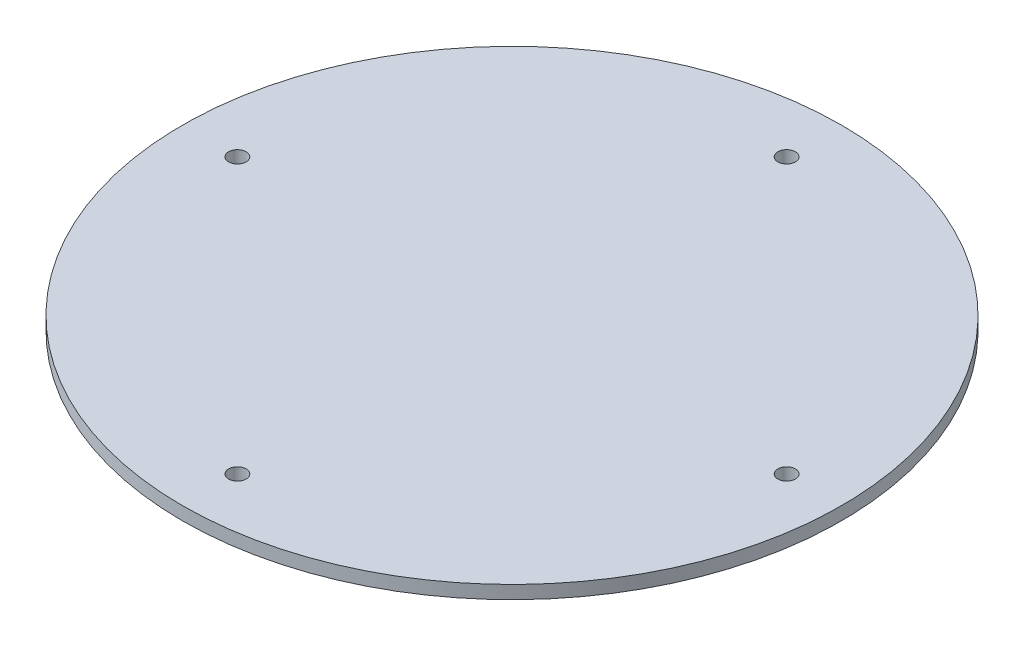
from build123d import *

# Parameters (mm, degrees)
SKETCH1_R           = 75
SKETCH1_R_2         = 2
BOSS_EXTRUDE1_DEPTH = 3


with BuildPart() as part:
    # Sketch1 → Boss-Extrude1 (new body)
    with BuildSketch(Plane(origin=(0, 0, 0), x_dir=(1, 0, 0), z_dir=(0, 1, 0))):
        with Locations(Location((0, 0, 0), (0, 0, 270))):
            Circle(SKETCH1_R)
        with Locations(Location((0, 62.5, 0), (0, 0, 270))):
            Circle(SKETCH1_R_2, mode=Mode.SUBTRACT)
        with Locations(Location((62.5, 0, 0), (0, 0, 270))):
            Circle(SKETCH1_R_2, mode=Mode.SUBTRACT)
        with Locations(Location((0, -62.5, 0), (0, 0, 270))):
            Circle(SKETCH1_R_2, mode=Mode.SUBTRACT)
        with Locations(Location((-62.5, 0, 0), (0, 0, 270))):
            Circle(SKETCH1_R_2, mode=Mode.SUBTRACT)
    extrude(amount=BOSS_EXTRUDE1_DEPTH)


solid = part.part
